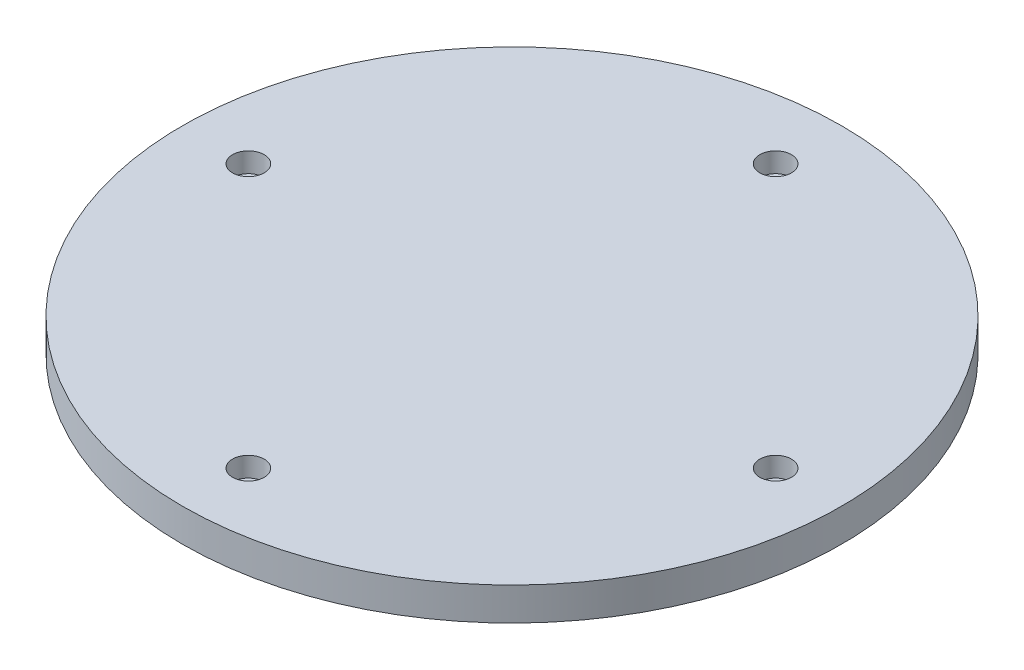
from build123d import *

# Parameters (mm, degrees)
SKETCH_1_R          = 50
EXTRUDE_1_DEPTH     = 5
SKETCH_3_R          = 2.25
CUT_EXTRUDE_1_DEPTH = 3
SKETCH_4_R          = 2.4
CUT_EXTRUDE_2_DEPTH = 3


with BuildPart() as part:
    # 草图1 → 凸台-拉伸1 (new body)
    with BuildSketch(Plane(origin=(0, 0, 0), x_dir=(1, 0, 0), z_dir=(0, 1, 0))):
        Circle(SKETCH_1_R)
    extrude(amount=EXTRUDE_1_DEPTH)

    # 草图3 → 切除-拉伸1 (cut)
    with BuildSketch(Plane.XZ):
        with Locations((8, 13.856406461)):
            Circle(SKETCH_3_R)
        with Locations((16, 0)):
            Circle(SKETCH_3_R)
        with Locations((8, -13.856406461)):
            Circle(SKETCH_3_R)
        with Locations((-8, -13.856406461)):
            Circle(SKETCH_3_R)
        with Locations((-16, 0)):
            Circle(SKETCH_3_R)
        with Locations((-8, 13.856406461)):
            Circle(SKETCH_3_R)
    extrude(amount=-CUT_EXTRUDE_1_DEPTH, mode=Mode.SUBTRACT)

    # 草图4 → 切除-拉伸2 (cut)
    with BuildSketch(Plane(origin=(0, 5, 0), x_dir=(1, 0, 0), z_dir=(0, 1, 0))):
        with Locations((0, 40)):
            Circle(SKETCH_4_R)
        with Locations((40, 0)):
            Circle(SKETCH_4_R)
        with Locations((0, -40)):
            Circle(SKETCH_4_R)
        with Locations((-40, 0)):
            Circle(SKETCH_4_R)
    extrude(amount=-CUT_EXTRUDE_2_DEPTH, mode=Mode.SUBTRACT)


solid = part.part
